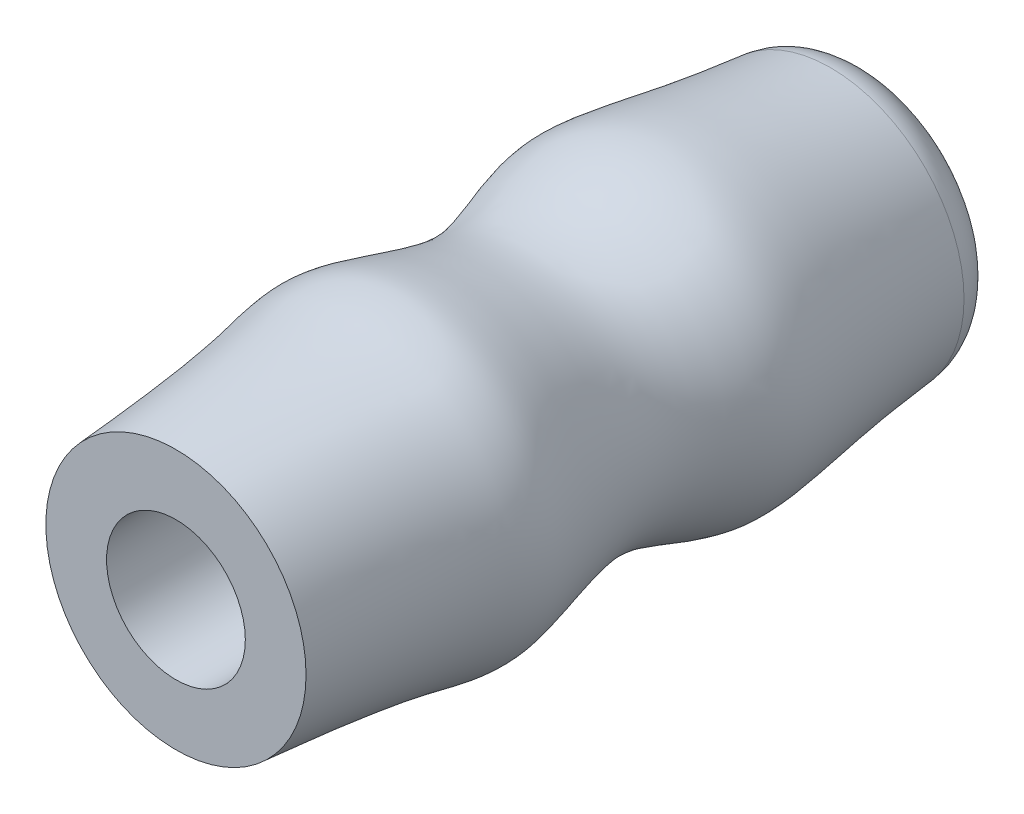
from build123d import *

# Parameters (mm, degrees)
FILETE1_R = 5


with BuildPart() as part:
    # Esboço1 → Revolução1 (revolve)
    with BuildSketch(Plane(origin=(0, 0, 0), x_dir=(1, 0, 0), z_dir=(0, 1, 0)), mode=Mode.PRIVATE) as revolu_o1_sk:
        with BuildLine():
            Line((-8, -35.11589404), (-8, 34.88410596))
            Line((-8, 34.88410596), (0, 34.88410596))
            Line((0, 34.88410596), (0, 44.88410596))
            Line((0, 44.88410596), (-15, 44.88410596))
            add(Edge.make_bspline(
                [(-15, -35.11589404), (-16.437380329, -16.197105938), (-17.767351708, -15.328809785), (-18.207630349, -6.630166317), (-12.435792941, 6.805870236), (-20.522166091, 17.935658643), (-16.080452493, 29.608779359), (-15, 44.88410596)],
                knots=[0, 0, 0, 0, 0.271149663, 0.323133852, 0.519841898, 0.746212756, 1, 1, 1, 1], degree=3))
            Line((-15, -35.11589404), (-8, -35.11589404))
        make_face()
    revolve(revolu_o1_sk.sketch.rotate(Axis((0, 0, 35.11589404), (0, 0, -1)), 180), axis=Axis((0, 0, 35.11589404), (0, 0, -1)))

    # Filete1
    filete1_edges = [part.edges().sort_by_distance(p)[0] for p in [
        (-15, 0, -44.88410596),
    ]]
    fillet(filete1_edges, radius=FILETE1_R)


solid = part.part
